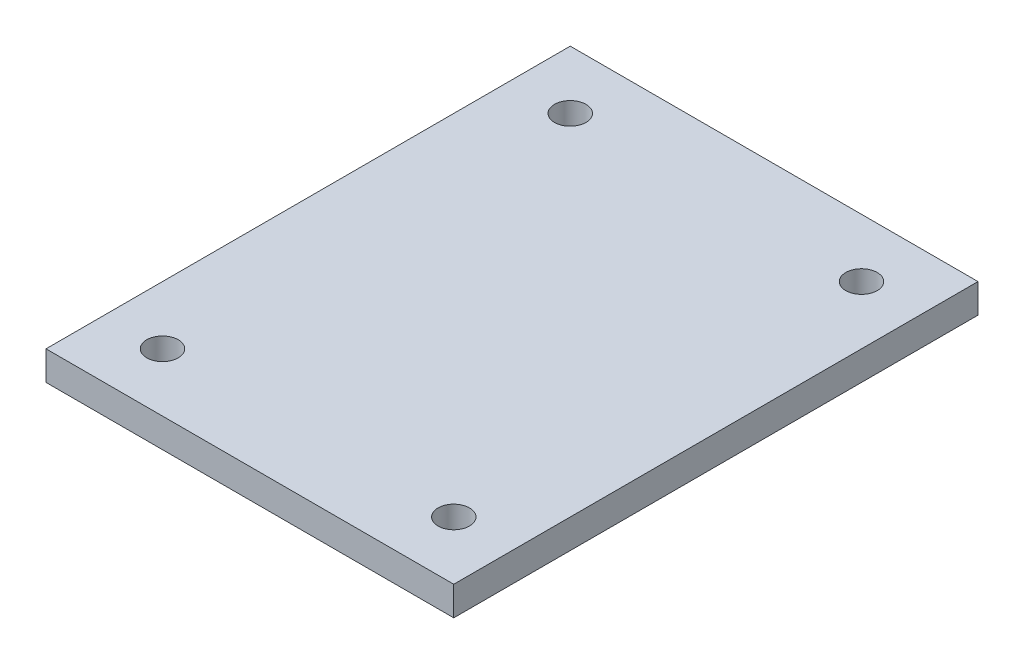
from build123d import *

# Parameters (mm, degrees)
SKETCH1_W           = 88.9
SKETCH1_H           = 114.3
BOSS_EXTRUDE1_DEPTH = 6.35
CUT_EXTRUDE2_REACH  = 74.679
SKETCH3_R           = 3.429


with BuildPart() as part:
    # Sketch1 → Boss-Extrude1 (new body)
    with BuildSketch(Plane(origin=(0, 0, 0), x_dir=(1, 0, 0), z_dir=(0, 1, 0))):
        Rectangle(SKETCH1_W, SKETCH1_H)
    extrude(amount=BOSS_EXTRUDE1_DEPTH)

    # Sketch3 → Cut-Extrude2 (cut, up to next)
    with BuildSketch(Plane.XZ, mode=Mode.PRIVATE) as cut_extrude2_sk1:
        with Locations(Location((-31.75, 44.45, 0), (0, 0, 270))):
            Circle(SKETCH3_R)
    cut_extrude2_tool1 = extrude(cut_extrude2_sk1.sketch, amount=-CUT_EXTRUDE2_REACH, mode=Mode.PRIVATE) & part.part
    # Sketch3 → Cut-Extrude2 (cut, up to next)
    with BuildSketch(Plane.XZ, mode=Mode.PRIVATE) as cut_extrude2_sk2:
        with Locations(Location((-31.75, -44.45, 0), (0, 0, 90))):
            Circle(SKETCH3_R)
    cut_extrude2_tool2 = extrude(cut_extrude2_sk2.sketch, amount=-CUT_EXTRUDE2_REACH, mode=Mode.PRIVATE) & part.part
    # Sketch3 → Cut-Extrude2 (cut, up to next)
    with BuildSketch(Plane.XZ, mode=Mode.PRIVATE) as cut_extrude2_sk3:
        with Locations(Location((31.75, 44.45, 0), (0, 0, 90))):
            Circle(SKETCH3_R)
    cut_extrude2_tool3 = extrude(cut_extrude2_sk3.sketch, amount=-CUT_EXTRUDE2_REACH, mode=Mode.PRIVATE) & part.part
    # Sketch3 → Cut-Extrude2 (cut, up to next)
    with BuildSketch(Plane.XZ, mode=Mode.PRIVATE) as cut_extrude2_sk4:
        with Locations(Location((31.75, -44.45, 0), (0, 0, 270))):
            Circle(SKETCH3_R)
    cut_extrude2_tool4 = extrude(cut_extrude2_sk4.sketch, amount=-CUT_EXTRUDE2_REACH, mode=Mode.PRIVATE) & part.part
    add(cut_extrude2_tool1.solids().sort_by_distance((-31.75, 0, 44.45))[0], mode=Mode.SUBTRACT)
    add(cut_extrude2_tool2.solids().sort_by_distance((-31.75, 0, -44.45))[0], mode=Mode.SUBTRACT)
    add(cut_extrude2_tool3.solids().sort_by_distance((31.75, 0, 44.45))[0], mode=Mode.SUBTRACT)
    add(cut_extrude2_tool4.solids().sort_by_distance((31.75, 0, -44.45))[0], mode=Mode.SUBTRACT)


solid = part.part
